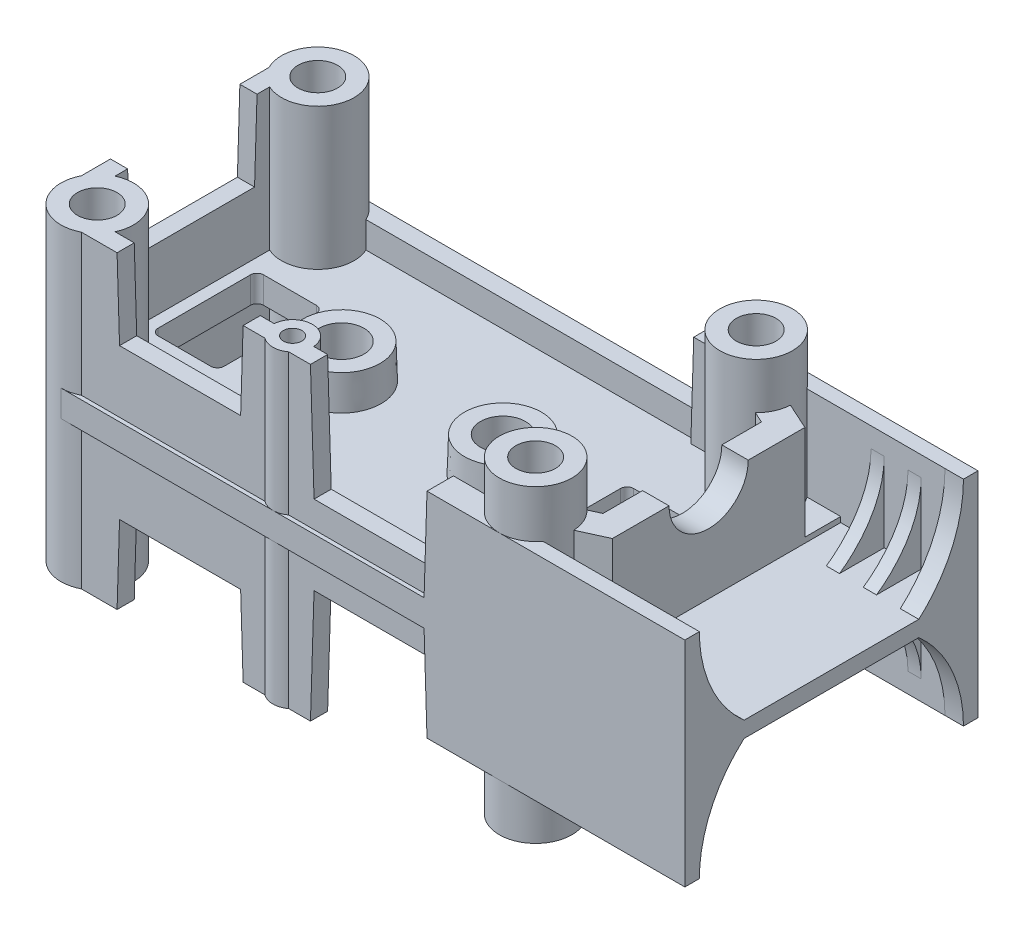
from build123d import *

# Parameters (mm, degrees)
SKETCH1_R                     = 2.75
BOSS_EXTRUDE1_DEPTH           = 10.7
BOSS_EXTRUDE1_2_DEPTH         = 10.7
BOSS_EXTRUDE1_3_DEPTH         = 10.7
BOSS_EXTRUDE1_4_DEPTH         = 10.7
SKETCH2_R                     = 2.75
BOSS_EXTRUDE2_DEPTH           = 1
BOSS_EXTRUDE3_START           = -0.3
BOSS_EXTRUDE3_DEPTH           = 1.3
BOSS_EXTRUDE4_START           = 7.1
BOSS_EXTRUDE4_DEPTH           = 7.1
CUT_EXTRUDE1_START            = -22.2
CUT_EXTRUDE1_DEPTH            = 22.2
BOSS_EXTRUDE5_START           = -0.3
SKETCH8_W                     = 27.562503123
SKETCH8_H                     = 2
BOSS_EXTRUDE5_DEPTH           = 1.3
BOSS_EXTRUDE6_START           = -0.3
BOSS_EXTRUDE6_DEPTH           = 1.3
SKETCH10_R                    = 1.5
BOSS_EXTRUDE7_DEPTH           = 10.7
SKETCH11_R                    = 1.5
CUT_EXTRUDE2_DEPTH            = 10.7
SKETCH12_R                    = 0.7
CUT_EXTRUDE3_DEPTH            = 2.5
SKETCH13_R                    = 3
BOSS_EXTRUDE8_DEPTH           = 2.6
BOSS_EXTRUDE8_DRAFT           = 1.79
BOSS_EXTRUDE8_PROFILE_2_DEPTH = 2.6
BOSS_EXTRUDE8_PROFILE_2_DRAFT = 1.79
SKETCH14_R                    = 1.7
CUT_EXTRUDE4_DEPTH            = 3.6
SKETCH15_W                    = 5
SKETCH15_H                    = 8
SKETCH15_W_2                  = 7
CUT_EXTRUDE5_DEPTH            = 1
BOSS_EXTRUDE9_START           = 7.2
BOSS_EXTRUDE9_DEPTH           = 7.2
SKETCH17_R                    = 3
CUT_EXTRUDE6_DEPTH            = 2
SKETCH18_W                    = 9.299999997
SKETCH18_H                    = 20
CUT_EXTRUDE7_DEPTH            = 0.4
FILLET1_R                     = 0.5
BOSS_EXTRUDE10_DEPTH          = 1.4
BOSS_EXTRUDE11_START          = -3.2
BOSS_EXTRUDE11_DEPTH          = 1
BOSS_EXTRUDE12_START          = -6
BOSS_EXTRUDE12_DEPTH          = 1


with BuildPart() as part:
    # Sketch1 → Boss-Extrude1 (new body)
    with BuildSketch(Plane(origin=(0, 0, 0), x_dir=(1, 0, 0), z_dir=(0, 1, 0))):
        with Locations(Location((-16.6, 8.35, 0), (0, 0, 270))):
            Circle(SKETCH1_R)
    extrude(amount=BOSS_EXTRUDE1_DEPTH)



with BuildPart() as body_2:
    # Sketch1 → Boss-Extrude1 2 (new body)
    with BuildSketch(Plane(origin=(0, 0, 0), x_dir=(1, 0, 0), z_dir=(0, 1, 0))):
        with Locations(Location((-16.6, -8.35, 0), (0, 0, 270))):
            Circle(SKETCH1_R)
    extrude(amount=BOSS_EXTRUDE1_2_DEPTH)


with BuildPart() as body_3:
    # Sketch1 → Boss-Extrude1 3 (new body)
    with BuildSketch(Plane(origin=(0, 0, 0), x_dir=(1, 0, 0), z_dir=(0, 1, 0))):
        with Locations(Location((16.6, -8.35, 0), (0, 0, 270))):
            Circle(SKETCH1_R)
    extrude(amount=BOSS_EXTRUDE1_3_DEPTH)


with BuildPart() as body_4:
    # Sketch1 → Boss-Extrude1 4 (new body)
    with BuildSketch(Plane(origin=(0, 0, 0), x_dir=(1, 0, 0), z_dir=(0, 1, 0))):
        with Locations(Location((16.6, 8.35, 0), (0, 0, 270))):
            Circle(SKETCH1_R)
    extrude(amount=BOSS_EXTRUDE1_4_DEPTH)


with BuildPart() as part_1:
    add(part.part)

    add(body_2.part)  # Boss-Extrude2 merges body 2

    add(body_3.part)  # Boss-Extrude2 merges body 3

    add(body_4.part)  # Boss-Extrude2 merges body 4
    # Sketch2 → Boss-Extrude2 (add)
    with BuildSketch(Plane(origin=(0, 10.7, 0), x_dir=(1, 0, 0), z_dir=(0, 1, 0))):
        with BuildLine():
            Line((30.65, 11.1), (-16.6, 11.1))
            ThreePointArc((-16.6, 11.1), (-18.544543648, 10.294543648), (-19.35, 8.35))
            Line((-19.35, 8.35), (-19.35, -8.35))
            ThreePointArc((-19.35, -8.35), (-16.6, -5.6), (-13.85, -8.35))
            ThreePointArc((-13.85, -8.35), (-14.655456352, -10.294543648), (-16.6, -11.1))
            Line((-16.6, -11.1), (30.65, -11.1))
            Line((30.65, -11.1), (30.65, 11.1))
        make_face()
        with Locations(Location((-16.6, -8.35, 0), (0, 0, 270))):
            Circle(SKETCH2_R)
    extrude(amount=BOSS_EXTRUDE2_DEPTH)

    # Sketch3 → Boss-Extrude3 (add)
    with BuildSketch(Plane.ZY.offset(19.35).offset(BOSS_EXTRUDE3_START)):
        Polygon((8.35, 10.7), (-8.35, 10.7), (-8.35, 0), (-4.9, 0), (-4.71249063, 6), (4.71249063, 6), (4.9, 0), (8.35, 0), align=None)
    extrude(amount=-BOSS_EXTRUDE3_DEPTH)

    # Sketch5 → Boss-Extrude4 (add)
    with BuildSketch(Plane.XZ.offset(-10.7).offset(BOSS_EXTRUDE4_START)):
        with BuildLine():
            Line((18.8, 10), (30.65, 10))
            Line((30.65, 10), (30.65, 11.1))
            Line((30.65, 11.1), (16.6, 11.1))
            ThreePointArc((16.6, 11.1), (17.829837388, 10.809674775), (18.8, 10))
        make_face()
        with BuildLine():
            ThreePointArc((13.954248689, 9.1), (14.941687605, 10.543741097), (16.6, 11.1))
            Line((16.6, 11.1), (10.9, 11.1))
            Line((10.9, 11.1), (10.9, 9.1))
            Line((10.9, 9.1), (13.954248689, 9.1))
        make_face()
        with BuildLine():
            Line((30.65, -11.1), (30.65, -10))
            Line((30.65, -10), (18.8, -10))
            ThreePointArc((18.8, -10), (17.829837388, -10.809674775), (16.6, -11.1))
            Line((16.6, -11.1), (30.65, -11.1))
        make_face()
        with BuildLine():
            Line((10.9, -11.1), (16.6, -11.1))
            ThreePointArc((16.6, -11.1), (14.941687605, -10.543741097), (13.954248689, -9.1))
            Line((13.954248689, -9.1), (10.9, -9.1))
            Line((10.9, -9.1), (10.9, -11.1))
        make_face()
    extrude(amount=-BOSS_EXTRUDE4_DEPTH)

    # Sketch6 → Cut-Extrude1 (cut)
    with BuildSketch(Plane.XY.offset(11.1).offset(CUT_EXTRUDE1_START)):
        Polygon((10.9, 10.7), (11.121886088, 3.6), (10.9, 3.6), align=None)
    extrude(amount=CUT_EXTRUDE1_DEPTH, mode=Mode.SUBTRACT)

    # Sketch8 → Boss-Extrude5 (add)
    with BuildSketch(Plane(origin=(0, 0, -11.1), x_dir=(-1, 0, 0), z_dir=(0, 0, -1)).offset(BOSS_EXTRUDE5_START)):
        with Locations((2.818748439, 9.7)):
            Rectangle(SKETCH8_W, SKETCH8_H)
    extrude(amount=-BOSS_EXTRUDE5_DEPTH)

    # Sketch9 → Boss-Extrude6 (add)
    with BuildSketch(Plane.XY.offset(11.1).offset(BOSS_EXTRUDE6_START)):
        Polygon((-16.6, 10.7), (-16.6, 0), (-12.65, 0), (-12.46249063, 6), (-3.2918783, 6), (-3.10436893, 0), (1.99563107, 0), (2.267519657, 8.7), (10.962503123, 8.7), (10.9, 10.7), align=None)
    extrude(amount=-BOSS_EXTRUDE6_DEPTH)

    # Sketch10 → Boss-Extrude7 (add)
    with BuildSketch(Plane.XZ):
        with Locations((-0.55436893, 9.6)):
            Circle(SKETCH10_R)
    extrude(amount=-BOSS_EXTRUDE7_DEPTH)

    # Sketch11 → Cut-Extrude2 (cut)
    with BuildSketch(Plane.XZ):
        with Locations(Location((-16.6, 8.35, 0), (0, 0, 270))):
            Circle(SKETCH11_R)
        with Locations(Location((16.6, 8.35, 0), (0, 0, 270))):
            Circle(SKETCH11_R)
        with Locations(Location((16.6, -8.35, 0), (0, 0, 270))):
            Circle(SKETCH11_R)
        with Locations(Location((-16.6, -8.35, 0), (0, 0, 270))):
            Circle(SKETCH11_R)
    extrude(amount=-CUT_EXTRUDE2_DEPTH, mode=Mode.SUBTRACT)

    # Sketch12 → Cut-Extrude3 (cut)
    with BuildSketch(Plane.XZ):
        with Locations(Location((-0.55436893, 9.6, 0), (0, 0, 270))):
            Circle(SKETCH12_R)
    extrude(amount=-CUT_EXTRUDE3_DEPTH, mode=Mode.SUBTRACT)


with BuildPart() as boss_extrude8_tool:
    # Sketch13 → Boss-Extrude8 (with draft: the straight prism first)
    with BuildSketch(Plane.XZ.offset(-10.7)):
        with Locations((-6.45, 0)):
            Circle(SKETCH13_R)
    extrude(amount=BOSS_EXTRUDE8_DEPTH)
    # Boss-Extrude8: the draft: its side faces are tilted about the plane it starts from
    boss_extrude8_sides = [boss_extrude8_tool.faces().sort_by_distance(p)[0] for p in [
        (-9.45, 9.4, 0),
    ]]
    draft(boss_extrude8_sides, Plane.XZ.offset(-10.7), BOSS_EXTRUDE8_DRAFT)


with BuildPart() as part_2:
    add(part_1.part)

    # Boss-Extrude8: add boss_extrude8_tool
    add(boss_extrude8_tool.part)


with BuildPart() as boss_extrude8_profile_2_tool:
    # Sketch13 → Boss-Extrude8 profile 2 (with draft: the straight prism first)
    with BuildSketch(Plane.XZ.offset(-10.7)):
        with Locations((5.773575, 0)):
            Circle(SKETCH13_R)
    extrude(amount=BOSS_EXTRUDE8_PROFILE_2_DEPTH)
    # Boss-Extrude8 profile 2: the draft: its side faces are tilted about the plane it starts from
    boss_extrude8_profile_2_sides = [boss_extrude8_profile_2_tool.faces().sort_by_distance(p)[0] for p in [
        (2.773575, 9.4, 0),
    ]]
    draft(boss_extrude8_profile_2_sides, Plane.XZ.offset(-10.7), BOSS_EXTRUDE8_PROFILE_2_DRAFT)


with BuildPart() as part_3:
    add(part_2.part)

    # Boss-Extrude8 profile 2: add boss_extrude8_profile_2_tool
    add(boss_extrude8_profile_2_tool.part)

    # Sketch14 → Cut-Extrude4 (cut)
    with BuildSketch(Plane.XZ.offset(-8.1)):
        with Locations(Location((-6.45, 0, 0), (0, 0, 270))):
            Circle(SKETCH14_R)
        with Locations(Location((5.773575, 0, 0), (0, 0, 270))):
            Circle(SKETCH14_R)
    extrude(amount=-CUT_EXTRUDE4_DEPTH, mode=Mode.SUBTRACT)

    # Sketch15 → Cut-Extrude5 (cut)
    with BuildSketch(Plane.XZ.offset(-10.7)):
        with Locations((-14.35, 0)):
            Rectangle(SKETCH15_W, SKETCH15_H)
        with Locations((14.673575, 0)):
            Rectangle(SKETCH15_W_2, SKETCH15_H)
    extrude(amount=-CUT_EXTRUDE5_DEPTH, mode=Mode.SUBTRACT)

    # Sketch16 → Boss-Extrude9 (add)
    with BuildSketch(Plane.XZ.offset(-10.7).offset(BOSS_EXTRUDE9_START)):
        with BuildLine():
            Line((21.350000003, 7.288773533), (19.345906044, 8.2))
            ThreePointArc((19.345906044, 8.2), (19.103378549, 7.211757565), (18.518093363, 6.379361055))
            Line((18.518093363, 6.379361055), (19.350000003, 6.001107659))
            Line((19.350000003, 6.001107659), (19.350000003, 7.288773533))
            Line((19.350000003, 7.288773533), (21.350000003, 7.288773533))
        make_face()
        Polygon((20.522187323, 5.468134589), (21.350000003, 7.288773533), (19.350000003, 7.288773533), (19.350000003, 6.001107659), align=None)
        Polygon((21.350000003, -7.288773533), (21.350000003, 7.288773533), (20.522187323, 5.468134589), (19.350000003, 6.001107659), (19.350000003, -6.001107659), (20.522187323, -5.468134589), align=None)
        Polygon((19.350000003, -7.288773533), (21.350000003, -7.288773533), (20.522187323, -5.468134589), (19.350000003, -6.001107659), align=None)
        with BuildLine():
            Line((19.345906044, -8.2), (21.350000003, -7.288773533))
            Line((21.350000003, -7.288773533), (19.350000003, -7.288773533))
            Line((19.350000003, -7.288773533), (19.350000003, -6.001107659))
            Line((19.350000003, -6.001107659), (18.518093363, -6.379361055))
            ThreePointArc((18.518093363, -6.379361055), (19.103378549, -7.211757565), (19.345906044, -8.2))
        make_face()
    extrude(amount=-BOSS_EXTRUDE9_DEPTH)

    # Sketch17 → Cut-Extrude6 (cut)
    with BuildSketch(Plane(origin=(21.350000003, 0, 0), x_dir=(0, 0, -1), z_dir=(1, 0, 0))):
        with Locations((0, 3.5)):
            Circle(SKETCH17_R)
    extrude(amount=-CUT_EXTRUDE6_DEPTH, mode=Mode.SUBTRACT)

    # Sketch18 → Cut-Extrude7 (cut)
    with BuildSketch(Plane.XZ.offset(-10.7)):
        with Locations((26.000000002, 0)):
            Rectangle(SKETCH18_W, SKETCH18_H)
    extrude(amount=-CUT_EXTRUDE7_DEPTH, mode=Mode.SUBTRACT)

    # Fillet1
    fillet1_edges = [part_3.edges().sort_by_distance(p)[0] for p in [
        (-11.85, 11.2, -4),
        (-11.85, 11.2, 4),
        (-16.85, 11.2, 4),
        (-16.85, 11.2, -4),
        (18.173575, 11.2, -4),
        (18.173575, 11.2, 4),
        (11.173575, 11.2, 4),
        (11.173575, 11.2, -4),
    ]]
    fillet(fillet1_edges, radius=FILLET1_R)

    # Sketch19 → Boss-Extrude10 (add)
    with BuildSketch(Plane(origin=(30.65, 0, 0), x_dir=(0, 0, -1), z_dir=(1, 0, 0))):
        with BuildLine():
            add(Edge.make_bspline(
                [(10, 3.6), (10, 8.114162296), (6.614378278, 11.1)],
                knots=[0, 0, 0, 0.848062079, 0.848062079, 0.848062079], degree=2, weights=[1, 0.911437828, 1]))
            Line((10, 3.6), (10, 11.1))
            Line((10, 11.1), (6.614378278, 11.1))
        make_face()
        with BuildLine():
            Line((-10, 11.1), (-10, 3.6))
            add(Edge.make_bspline(
                [(-6.614378278, 11.1), (-10, 8.114162296), (-10, 3.6)],
                knots=[2.293530575, 2.293530575, 2.293530575, 3.141592654, 3.141592654, 3.141592654], degree=2, weights=[1, 0.911437828, 1]))
            Line((-6.614378278, 11.1), (-10, 11.1))
        make_face()
    extrude(amount=-BOSS_EXTRUDE10_DEPTH)

    # Sketch20 → Boss-Extrude11 (add)
    with BuildSketch(Plane(origin=(30.65, 0, 0), x_dir=(0, 0, -1), z_dir=(1, 0, 0)).offset(BOSS_EXTRUDE11_START)):
        with BuildLine():
            Line((-10, 11.1), (-10, 5.1))
            add(Edge.make_bspline(
                [(-6.614378278, 11.1), (-10, 8.711329837), (-10, 5.1)],
                knots=[2.293530575, 2.293530575, 2.293530575, 3.141592654, 3.141592654, 3.141592654], degree=2, weights=[1, 0.911437828, 1]))
            Line((-6.614378278, 11.1), (-10, 11.1))
        make_face()
        with BuildLine():
            add(Edge.make_bspline(
                [(10, 5.1), (10, 8.711329837), (6.614378278, 11.1)],
                knots=[0, 0, 0, 0.848062079, 0.848062079, 0.848062079], degree=2, weights=[1, 0.911437828, 1]))
            Line((10, 5.1), (10, 11.1))
            Line((10, 11.1), (6.614378278, 11.1))
        make_face()
    extrude(amount=-BOSS_EXTRUDE11_DEPTH)

    # Sketch21 → Boss-Extrude12 (add)
    with BuildSketch(Plane(origin=(30.65, 0, 0), x_dir=(0, 0, -1), z_dir=(1, 0, 0)).offset(BOSS_EXTRUDE12_START)):
        with BuildLine():
            add(Edge.make_bspline(
                [(-6.614378278, 11.1), (-10, 8.711329837), (-10, 5.1)],
                knots=[5.435123228, 5.435123228, 5.435123228, 6.283185307, 6.283185307, 6.283185307], degree=2, weights=[1, 0.911437828, 1]))
            Line((-6.614378278, 11.1), (-10, 11.1))
            Line((-10, 11.1), (-10, 5.1))
        make_face()
        with BuildLine():
            Line((10, 11.1), (6.614378278, 11.1))
            add(Edge.make_bspline(
                [(10, 5.1), (10, 8.711329837), (6.614378278, 11.1)],
                knots=[3.141592654, 3.141592654, 3.141592654, 3.989654733, 3.989654733, 3.989654733], degree=2, weights=[1, 0.911437828, 1]))
            Line((10, 5.1), (10, 11.1))
        make_face()
    extrude(amount=-BOSS_EXTRUDE12_DEPTH)

    # Mirror2: part across plane


with BuildPart() as part_4:
    add(part_3.part)
    add(part_3.part.mirror(Plane.ZX.offset(11.7)))


solid = part_4.part
